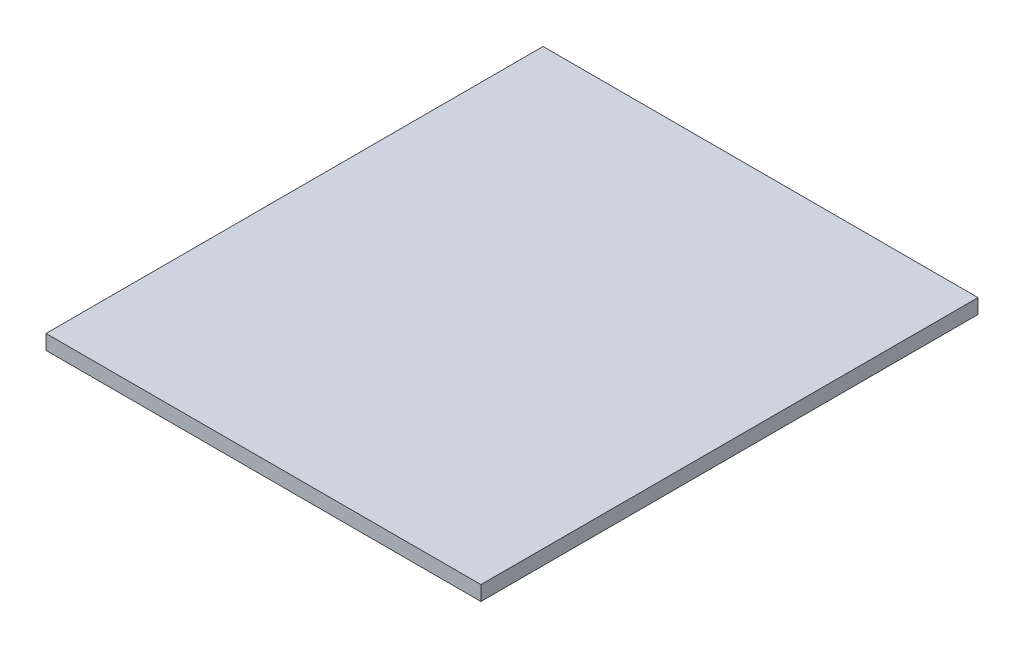
from build123d import *

# Parameters (mm, degrees)
SKETCH1_W           = 177.8
SKETCH1_H           = 203.2
BOSS_EXTRUDE1_DEPTH = 6


with BuildPart() as part:
    # Sketch1 → Boss-Extrude1 (new body)
    with BuildSketch(Plane(origin=(0, 0, 0), x_dir=(1, 0, 0), z_dir=(0, 1, 0))):
        Rectangle(SKETCH1_W, SKETCH1_H)
    extrude(amount=BOSS_EXTRUDE1_DEPTH)


solid = part.part
